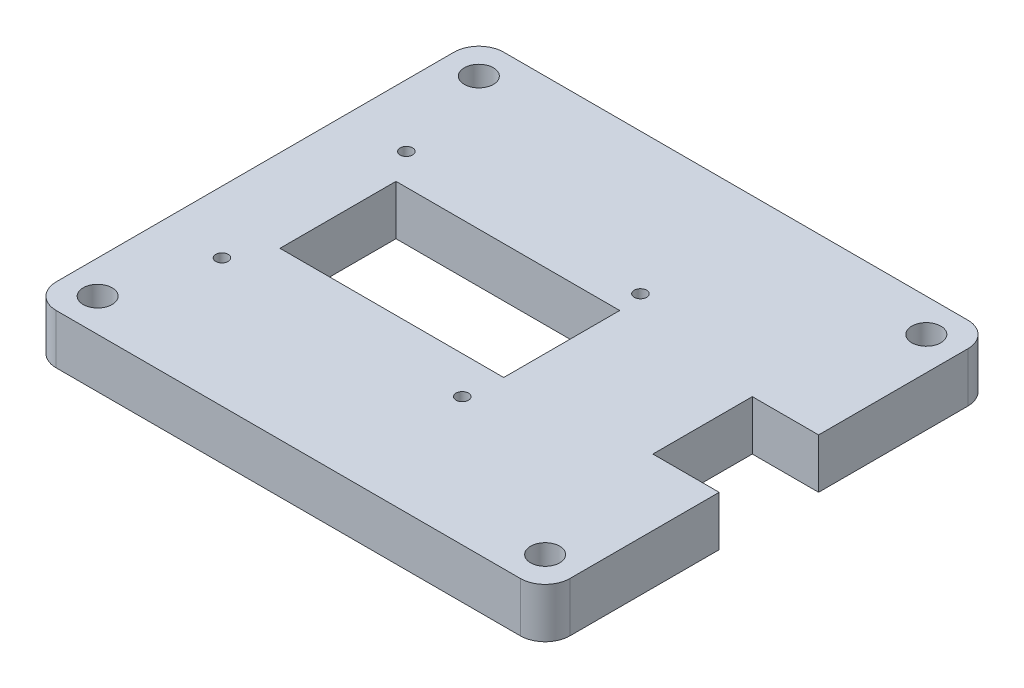
from build123d import *

# Parameters (mm, degrees)
SKETCH1_W           = 62
SKETCH1_H           = 54
SKETCH1_W_2         = 27
SKETCH1_H_2         = 14
BOSS_EXTRUDE1_DEPTH = 6
SKETCH2_R           = 0.75
CUT_EXTRUDE1_DEPTH  = 63.417946137
SKETCH3_R           = 1.75
CUT_EXTRUDE2_DEPTH  = 63.417946137
FILLET1_R           = 3
SKETCH4_W           = 16
SKETCH4_H           = 12
CUT_EXTRUDE3_DEPTH  = 63.417946137


with BuildPart() as part:
    # Sketch1 → Boss-Extrude1 (new body)
    with BuildSketch(Plane(origin=(0, 0, 0), x_dir=(1, 0, 0), z_dir=(0, 1, 0))):
        with Locations((21, -7)):
            Rectangle(SKETCH1_W, SKETCH1_H)
        with Locations((13.5, -7)):
            Rectangle(SKETCH1_W_2, SKETCH1_H_2, mode=Mode.SUBTRACT)
    extrude(amount=BOSS_EXTRUDE1_DEPTH)

    # Sketch2 → Cut-Extrude1 (cut, through all)
    with BuildSketch(Plane(origin=(0, 6, 0), x_dir=(1, 0, 0), z_dir=(0, 1, 0))):
        with Locations(Location((-2.5, 3.75, 0), (0, 0, 270))):
            Circle(SKETCH2_R)
        with Locations(Location((-2.5, -18.5, 0), (0, 0, 270))):
            Circle(SKETCH2_R)
        with Locations(Location((26.5, 3, 0), (0, 0, 270))):
            Circle(SKETCH2_R)
        with Locations(Location((26.5, -18.5, 0), (0, 0, 270))):
            Circle(SKETCH2_R)
    extrude(amount=-CUT_EXTRUDE1_DEPTH, mode=Mode.SUBTRACT)

    # Sketch3 → Cut-Extrude2 (cut, through all)
    with BuildSketch(Plane(origin=(0, 6, 0), x_dir=(1, 0, 0), z_dir=(0, 1, 0))):
        with Locations(Location((-6, 16, 0), (0, 0, 270))):
            Circle(SKETCH3_R)
        with Locations(Location((-6, -30, 0), (0, 0, 270))):
            Circle(SKETCH3_R)
        with Locations(Location((48, 16, 0), (0, 0, 270))):
            Circle(SKETCH3_R)
        with Locations(Location((48, -30, 0), (0, 0, 270))):
            Circle(SKETCH3_R)
    extrude(amount=-CUT_EXTRUDE2_DEPTH, mode=Mode.SUBTRACT)

    # Fillet1
    fillet1_edges = [part.edges().sort_by_distance(p)[0] for p in [
        (-10, 3, -20),
        (52, 3, -20),
        (52, 3, 34),
        (-10, 3, 34),
    ]]
    fillet(fillet1_edges, radius=FILLET1_R)

    # Sketch4 → Cut-Extrude3 (cut, through all)
    with BuildSketch(Plane(origin=(0, 6, 0), x_dir=(1, 0, 0), z_dir=(0, 1, 0))):
        with Locations((52, -7)):
            Rectangle(SKETCH4_W, SKETCH4_H)
    extrude(amount=-CUT_EXTRUDE3_DEPTH, mode=Mode.SUBTRACT)


solid = part.part
